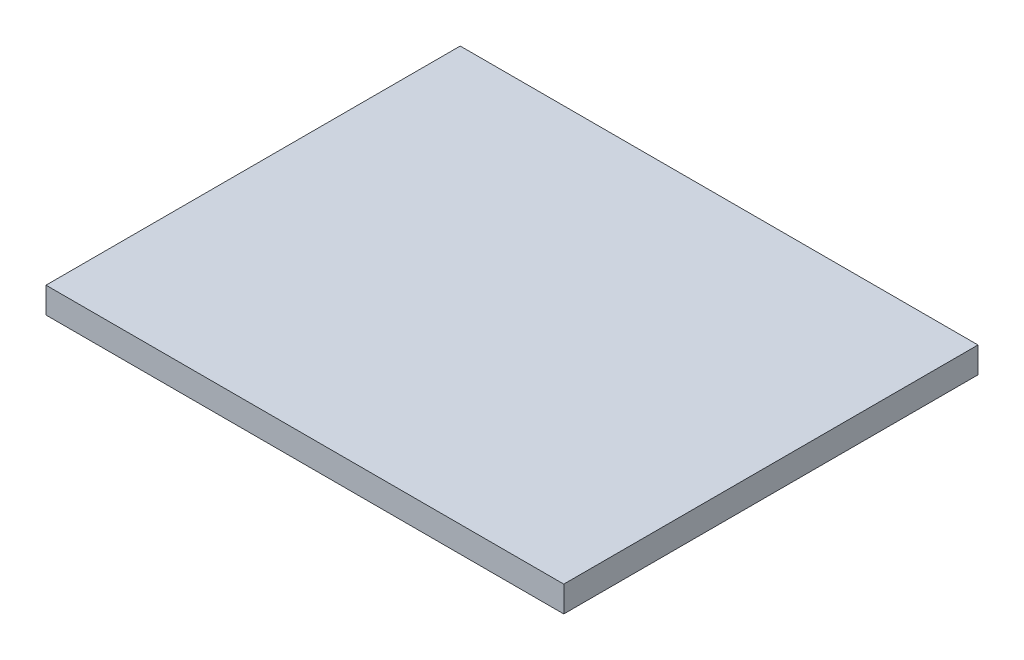
from build123d import *

# Parameters (mm, degrees)
SKETCH1_W           = 2
SKETCH1_H           = 1.6
BOSS_EXTRUDE1_DEPTH = 0.1


with BuildPart() as part:
    # Sketch1 → Boss-Extrude1 (new body)
    with BuildSketch(Plane(origin=(0, 0, 0), x_dir=(1, 0, 0), z_dir=(0, 1, 0))):
        Rectangle(SKETCH1_W, SKETCH1_H)
    extrude(amount=BOSS_EXTRUDE1_DEPTH)


solid = part.part
